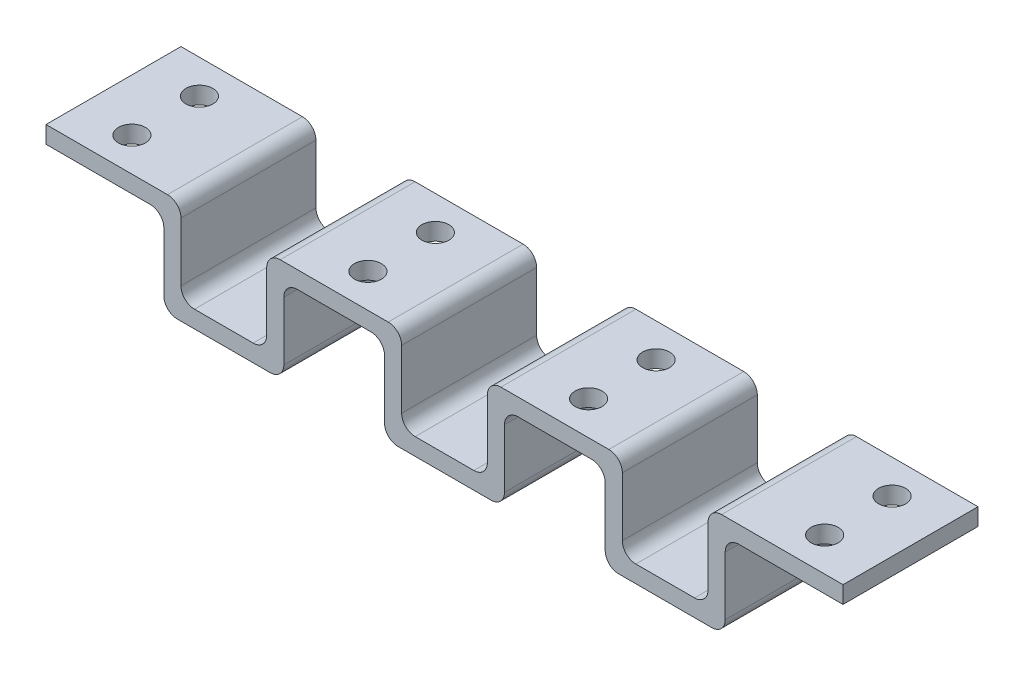
from build123d import *

# Parameters (mm, degrees)
BOSS_EXTRUDE1_DEPTH = 100
SKETCH2_R           = 10
CUT_EXTRUDE1_DEPTH  = 140.26


with BuildPart() as part:
    # Sketch1 → Boss-Extrude1 (new body)
    with BuildSketch(Plane.XY):
        with BuildLine():
            Line((-23.336691171, 0), (20.163308829, 0))
            ThreePointArc((20.163308829, 0), (27.234376641, 2.928932188), (30.163308829, 10))
            Line((30.163308829, 10), (30.163308829, 53.5))
            ThreePointArc((30.163308829, 53.5), (33.092241017, 60.571067812), (40.163308829, 63.5))
            Line((40.163308829, 63.5), (80.163308829, 63.5))
            Line((80.163308829, 63.5), (120.163308829, 63.5))
            ThreePointArc((120.163308829, 63.5), (127.234376641, 60.571067812), (130.163308829, 53.5))
            Line((130.163308829, 53.5), (130.163308829, 10))
            ThreePointArc((130.163308829, 10), (133.092241017, 2.928932188), (140.163308829, 0))
            Line((140.163308829, 0), (183.663308829, 0))
            ThreePointArc((183.663308829, 0), (190.734376641, 2.928932188), (193.663308829, 10))
            Line((193.663308829, 10), (193.663308829, 53.5))
            ThreePointArc((193.663308829, 53.5), (196.592241017, 60.571067812), (203.663308829, 63.5))
            Line((203.663308829, 63.5), (293.663308829, 63.5))
            Line((293.663308829, 63.5), (293.663308829, 50.8))
            Line((293.663308829, 50.8), (216.363308829, 50.8))
            ThreePointArc((216.363308829, 50.8), (209.292241017, 47.871067812), (206.363308829, 40.8))
            Line((206.363308829, 40.8), (206.363308829, -2.7))
            ThreePointArc((206.363308829, -2.7), (203.434376641, -9.771067812), (196.363308829, -12.7))
            Line((196.363308829, -12.7), (127.463308829, -12.7))
            ThreePointArc((127.463308829, -12.7), (120.392241017, -9.771067812), (117.463308829, -2.7))
            Line((117.463308829, -2.7), (117.463308829, 40.8))
            ThreePointArc((117.463308829, 40.8), (114.534376641, 47.871067812), (107.463308829, 50.8))
            Line((107.463308829, 50.8), (80.163308829, 50.8))
            Line((80.163308829, 50.8), (52.863308829, 50.8))
            ThreePointArc((52.863308829, 50.8), (45.792241017, 47.871067812), (42.863308829, 40.8))
            Line((42.863308829, 40.8), (42.863308829, -2.7))
            ThreePointArc((42.863308829, -2.7), (39.934376641, -9.771067812), (32.863308829, -12.7))
            Line((32.863308829, -12.7), (-36.036691171, -12.7))
            ThreePointArc((-36.036691171, -12.7), (-43.107758983, -9.771067812), (-46.036691171, -2.7))
            Line((-46.036691171, -2.7), (-46.036691171, 40.8))
            ThreePointArc((-46.036691171, 40.8), (-48.965623359, 47.871067812), (-56.036691171, 50.8))
            Line((-56.036691171, 50.8), (-83.336691171, 50.8))
            Line((-83.336691171, 50.8), (-110.636691171, 50.8))
            ThreePointArc((-110.636691171, 50.8), (-117.707758983, 47.871067812), (-120.636691171, 40.8))
            Line((-120.636691171, 40.8), (-120.636691171, -2.7))
            ThreePointArc((-120.636691171, -2.7), (-123.565623359, -9.771067812), (-130.636691171, -12.7))
            Line((-130.636691171, -12.7), (-199.536691171, -12.7))
            ThreePointArc((-199.536691171, -12.7), (-206.607758983, -9.771067812), (-209.536691171, -2.7))
            Line((-209.536691171, -2.7), (-209.536691171, 40.8))
            ThreePointArc((-209.536691171, 40.8), (-212.465623359, 47.871067812), (-219.536691171, 50.8))
            Line((-219.536691171, 50.8), (-296.836691171, 50.8))
            Line((-296.836691171, 50.8), (-296.836691171, 63.5))
            Line((-296.836691171, 63.5), (-206.836691171, 63.5))
            ThreePointArc((-206.836691171, 63.5), (-199.765623359, 60.571067812), (-196.836691171, 53.5))
            Line((-196.836691171, 53.5), (-196.836691171, 10))
            ThreePointArc((-196.836691171, 10), (-193.907758983, 2.928932188), (-186.836691171, 0))
            Line((-186.836691171, 0), (-143.336691171, 0))
            ThreePointArc((-143.336691171, 0), (-136.265623359, 2.928932188), (-133.336691171, 10))
            Line((-133.336691171, 10), (-133.336691171, 53.5))
            ThreePointArc((-133.336691171, 53.5), (-130.407758983, 60.571067812), (-123.336691171, 63.5))
            Line((-123.336691171, 63.5), (-83.336691171, 63.5))
            Line((-83.336691171, 63.5), (-43.336691171, 63.5))
            ThreePointArc((-43.336691171, 63.5), (-36.265623359, 60.571067812), (-33.336691171, 53.5))
            Line((-33.336691171, 53.5), (-33.336691171, 10))
            ThreePointArc((-33.336691171, 10), (-30.407758983, 2.928932188), (-23.336691171, 0))
        make_face()
    extrude(amount=BOSS_EXTRUDE1_DEPTH)

    # Sketch2 → Cut-Extrude1 (cut)
    with BuildSketch(Plane(origin=(0, 0, 0), x_dir=(1, 0, 0), z_dir=(0, 1, 0))):
        with Locations((-258.186691171, -75)):
            Circle(SKETCH2_R)
        with Locations((-258.186691171, -25)):
            Circle(SKETCH2_R)
        with Locations(Location((-83.336691171, -75, 0), (0, 0, 180))):
            Circle(SKETCH2_R)
        with Locations(Location((-83.336691171, -25, 0), (0, 0, 180))):
            Circle(SKETCH2_R)
        with Locations(Location((80.163308829, -75, 0), (0, 0, 90))):
            Circle(SKETCH2_R)
        with Locations(Location((80.163308829, -25, 0), (0, 0, 90))):
            Circle(SKETCH2_R)
        with Locations((255.013308829, -75)):
            Circle(SKETCH2_R)
        with Locations((255.013308829, -25)):
            Circle(SKETCH2_R)
    extrude(amount=CUT_EXTRUDE1_DEPTH, mode=Mode.SUBTRACT)


solid = part.part
